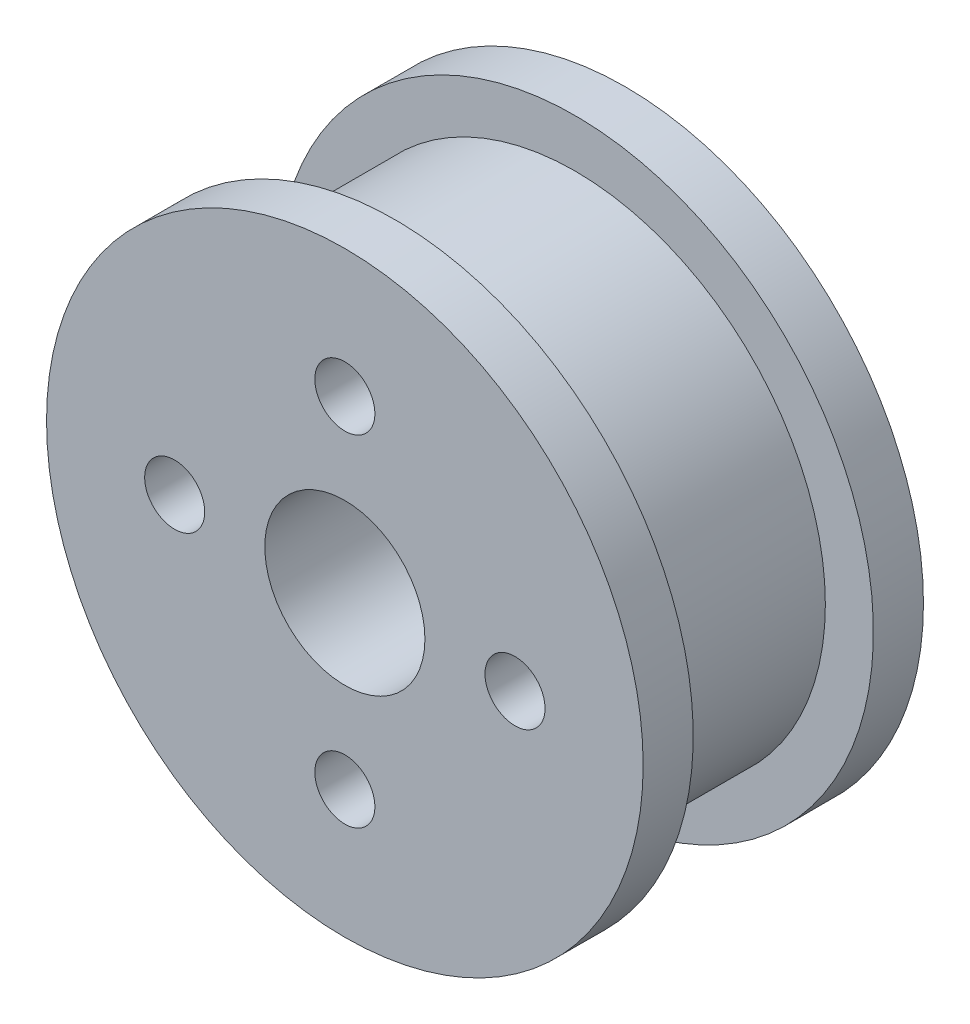
from build123d import *

# Parameters (mm, degrees)
SKETCH1_R           = 14.9
SKETCH1_R_2         = 4
BOSS_EXTRUDE1_DEPTH = 14
SKETCH2_R           = 14.9
SKETCH2_R_2         = 12.5
CUT_EXTRUDE1_DEPTH  = 9
SKETCH3_R           = 1.5
CUT_EXTRUDE2_DEPTH  = 26.298616563


with BuildPart() as part:
    # Sketch1 → Boss-Extrude1 (new body)
    with BuildSketch(Plane.XY):
        Circle(SKETCH1_R)
        Circle(SKETCH1_R_2, mode=Mode.SUBTRACT)
    extrude(amount=BOSS_EXTRUDE1_DEPTH)

    # Sketch2 → Cut-Extrude1 (cut)
    with BuildSketch(Plane(origin=(0, 0, 2.5), x_dir=(-1, 0, 0), z_dir=(0, 0, -1))):
        Circle(SKETCH2_R)
        Circle(SKETCH2_R_2, mode=Mode.SUBTRACT)
    extrude(amount=-CUT_EXTRUDE1_DEPTH, mode=Mode.SUBTRACT)

    # Sketch3 → Cut-Extrude2 (cut, through all)
    with BuildSketch(Plane(origin=(0, 0, 0), x_dir=(-1, 0, 0), z_dir=(0, 0, -1))):
        with Locations((0, 8.5)):
            Circle(SKETCH3_R)
        with Locations((8.5, 0)):
            Circle(SKETCH3_R)
        with Locations((0, -8.5)):
            Circle(SKETCH3_R)
        with Locations((-8.5, 0)):
            Circle(SKETCH3_R)
    extrude(amount=-CUT_EXTRUDE2_DEPTH, mode=Mode.SUBTRACT)


solid = part.part
